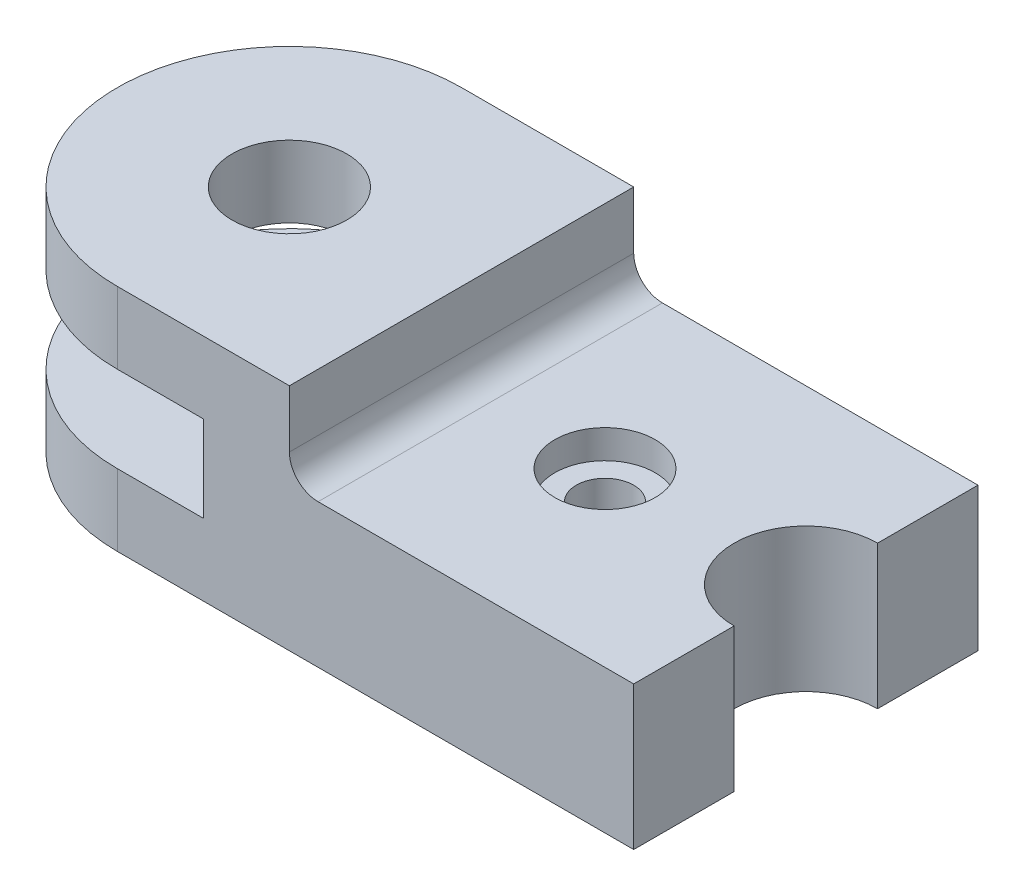
from build123d import *

# Parameters (mm, degrees)
BOSS_EXTRUDE1_DEPTH     = 50.8
CUT_EXTRUDE1_DEPTH      = 147.463544952
CUT_EXTRUDE1_DEPTH_BACK = 147.463544952
FILLET1_R               = 6.35
SKETCH5_W               = 19.05
SKETCH5_H               = 19.05
SKETCH5_W_2             = 47.515662577
CUT_EXTRUDE2_DEPTH      = 147.463544952
SKETCH6_R               = 12.7
CUT_EXTRUDE3_DEPTH      = 131.754502791
SKETCH7_R               = 15.875
SKETCH7_R_2             = 6.35
CUT_EXTRUDE4_DEPTH      = 125.595997127
SKETCH8_R               = 11.1125
CUT_EXTRUDE5_DEPTH      = 6.35


with BuildPart() as part:
    # Sketch2 → Boss-Extrude1 (new body)
    with BuildSketch(Plane(origin=(0, 0, 0), x_dir=(1, 0, 0), z_dir=(0, 1, 0))):
        with BuildLine():
            Line((0, -38.1), (114.3, -38.1))
            Line((114.3, -38.1), (114.3, 38.1))
            Line((114.3, 38.1), (0, 38.1))
            ThreePointArc((0, 38.1), (-38.1, 0), (0, -38.1))
        make_face()
    extrude(amount=BOSS_EXTRUDE1_DEPTH)

    # Sketch3 → Cut-Extrude1 (cut, two sides: drawn at the far end of the back side and taken through both)
    with BuildSketch(Plane.XY.offset(38.1).offset(-CUT_EXTRUDE1_DEPTH_BACK)):
        Polygon((38.1, 372.144327072), (38.1, 50.8), (38.1, 31.75), (114.3, 31.75), (435.644327072, 31.75), (853.647106265, 519.932735), (456.102779193, 860.327062073), align=None)
    extrude(amount=CUT_EXTRUDE1_DEPTH + CUT_EXTRUDE1_DEPTH_BACK, mode=Mode.SUBTRACT)

    # Fillet1
    fillet1_edges = [part.edges().sort_by_distance(p)[0] for p in [
        (38.1, 31.75, 0),
    ]]
    fillet(fillet1_edges, radius=FILLET1_R)

    # Sketch5 → Cut-Extrude2 (cut, through all)
    with BuildSketch(Plane.XY.offset(38.1)):
        with Locations((9.525, 25.4)):
            Rectangle(SKETCH5_W, SKETCH5_H)
        with Locations((-23.757831289, 25.4)):
            Rectangle(SKETCH5_W_2, SKETCH5_H)
    extrude(amount=-CUT_EXTRUDE2_DEPTH, mode=Mode.SUBTRACT)

    # Sketch6 → Cut-Extrude3 (cut, through all)
    with BuildSketch(Plane(origin=(0, 50.8, 0), x_dir=(1, 0, 0), z_dir=(0, 1, 0))):
        with Locations(Location((0, 0, 0), (0, 0, 270))):
            Circle(SKETCH6_R)
    extrude(amount=-CUT_EXTRUDE3_DEPTH, mode=Mode.SUBTRACT)

    # Sketch7 → Cut-Extrude4 (cut, through all)
    with BuildSketch(Plane(origin=(0, 31.75, 0), x_dir=(1, 0, 0), z_dir=(0, 1, 0))):
        with Locations((114.3, 0)):
            Circle(SKETCH7_R)
        with Locations(Location((69.85, 0, 0), (0, 0, 270))):
            Circle(SKETCH7_R_2)
    extrude(amount=-CUT_EXTRUDE4_DEPTH, mode=Mode.SUBTRACT)

    # Sketch8 → Cut-Extrude5 (cut)
    with BuildSketch(Plane(origin=(0, 31.75, 0), x_dir=(1, 0, 0), z_dir=(0, 1, 0))):
        with Locations(Location((69.85, 0, 0), (0, 0, 270))):
            Circle(SKETCH8_R)
    extrude(amount=-CUT_EXTRUDE5_DEPTH, mode=Mode.SUBTRACT)


solid = part.part
